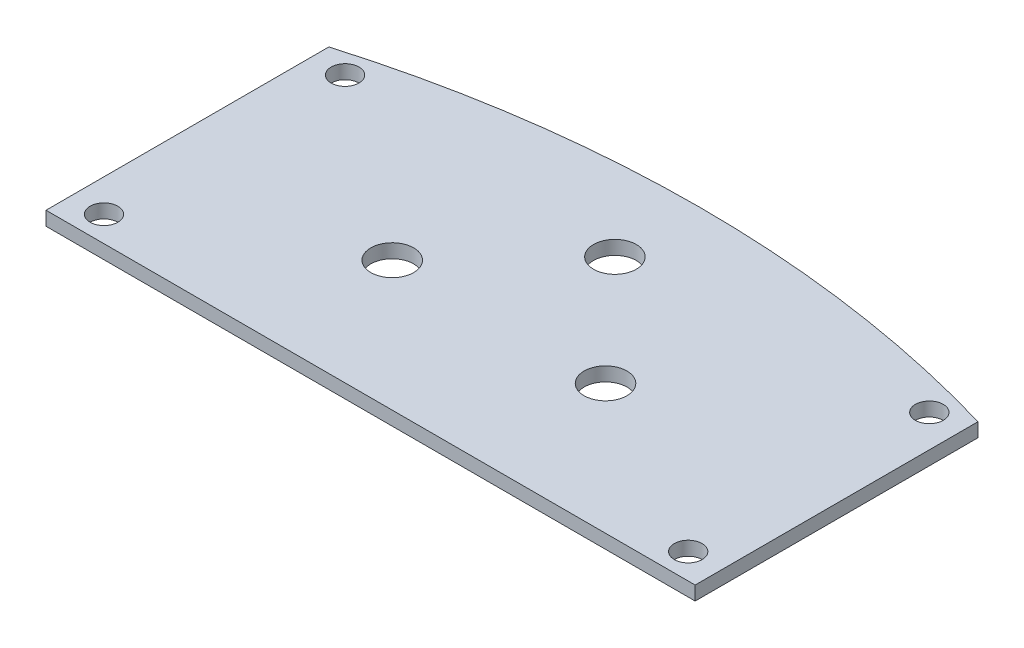
from build123d import *

# Parameters (mm, degrees)
BOSS_EXTRUDE1_DEPTH = 3
SKETCH3_R           = 3
CUT_EXTRUDE1_DEPTH  = 10
SKETCH4_R           = 4.62
CUT_EXTRUDE2_DEPTH  = 10


with BuildPart() as part:
    # Sketch1 → Boss-Extrude1 (new body)
    with BuildSketch(Plane(origin=(0, 0, 0), x_dir=(1, 0, 0), z_dir=(0, 1, 0))):
        with BuildLine():
            Line((70, 28.5), (70, -32.5))
            Line((70, -32.5), (-70, -32.5))
            Line((-70, -32.5), (-70, 28.5))
            ThreePointArc((-70, 28.5), (0, 38.554020598), (70, 28.5))
        make_face()
    extrude(amount=BOSS_EXTRUDE1_DEPTH)

    # Sketch3 → Cut-Extrude1 (cut)
    with BuildSketch(Plane(origin=(0, 3, 0), x_dir=(1, 0, 0), z_dir=(0, 1, 0))):
        with Locations(Location((-63, 25, 0), (0, 0, 270))):
            Circle(SKETCH3_R)
        with Locations(Location((-63, -27, 0), (0, 0, 270))):
            Circle(SKETCH3_R)
        with Locations(Location((63, 25, 0), (0, 0, 270))):
            Circle(SKETCH3_R)
        with Locations(Location((63, -27, 0), (0, 0, 270))):
            Circle(SKETCH3_R)
    extrude(amount=-CUT_EXTRUDE1_DEPTH, mode=Mode.SUBTRACT)

    # Sketch4 → Cut-Extrude2 (cut)
    with BuildSketch(Plane(origin=(0, 0, 0), x_dir=(-1, 0, 0), z_dir=(0, -1, 0))):
        with Locations(Location((23.33, -4.5, 0), (0, 0, 90))):
            Circle(SKETCH4_R)
        with Locations(Location((-22.67, -4.5, 0), (0, 0, 90))):
            Circle(SKETCH4_R)
        with Locations(Location((-0.055991236, 20.138512818, 0), (0, 0, 90))):
            Circle(SKETCH4_R)
    extrude(amount=-CUT_EXTRUDE2_DEPTH, mode=Mode.SUBTRACT)


solid = part.part
